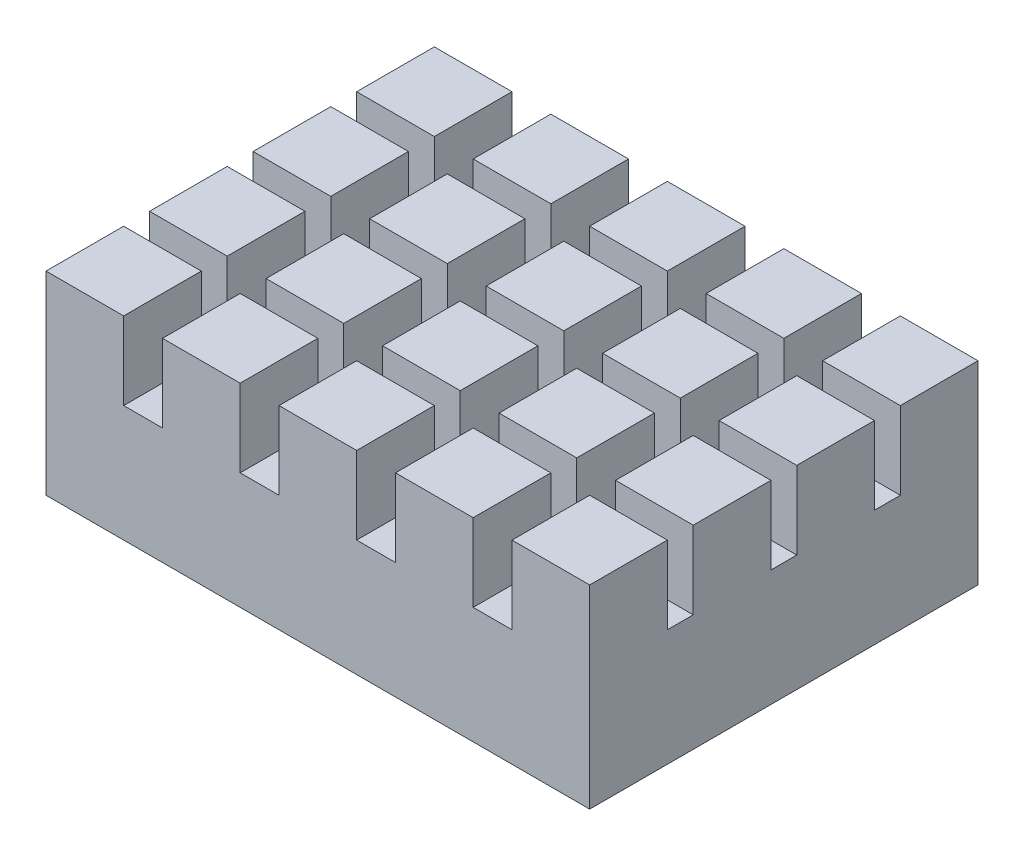
from build123d import *

# Parameters (mm, degrees)
SKETCH1_W           = 14
SKETCH1_H           = 10
BOSS_EXTRUDE1_DEPTH = 3
SKETCH2_W           = 2
SKETCH2_H           = 2
BOSS_EXTRUDE2_DEPTH = 2


with BuildPart() as part:
    # Sketch1 → Boss-Extrude1 (new body)
    with BuildSketch(Plane(origin=(0, 0, 0), x_dir=(1, 0, 0), z_dir=(0, 1, 0))):
        with Locations((7, 5)):
            Rectangle(SKETCH1_W, SKETCH1_H)
    extrude(amount=BOSS_EXTRUDE1_DEPTH)

    # Sketch2 → Boss-Extrude2 (add)
    with BuildSketch(Plane(origin=(0, 3, 0), x_dir=(1, 0, 0), z_dir=(0, 1, 0))):
        with Locations((4, 1)):
            Rectangle(SKETCH2_W, SKETCH2_H)
        with Locations((1, 1)):
            Rectangle(SKETCH2_W, SKETCH2_H)
        with Locations((7, 1)):
            Rectangle(SKETCH2_W, SKETCH2_H)
        with Locations((10, 1)):
            Rectangle(SKETCH2_W, SKETCH2_H)
        with Locations((4, 3.666666667)):
            Rectangle(SKETCH2_W, SKETCH2_H)
        with Locations((7, 3.666666667)):
            Rectangle(SKETCH2_W, SKETCH2_H)
        with Locations((10, 3.666666667)):
            Rectangle(SKETCH2_W, SKETCH2_H)
        with Locations((4, 6.333333333)):
            Rectangle(SKETCH2_W, SKETCH2_H)
        with Locations((7, 6.333333333)):
            Rectangle(SKETCH2_W, SKETCH2_H)
        with Locations((10, 6.333333333)):
            Rectangle(SKETCH2_W, SKETCH2_H)
        with Locations((4, 9)):
            Rectangle(SKETCH2_W, SKETCH2_H)
        with Locations((7, 9)):
            Rectangle(SKETCH2_W, SKETCH2_H)
        with Locations((10, 9)):
            Rectangle(SKETCH2_W, SKETCH2_H)
        with Locations((1, 3.666666667)):
            Rectangle(SKETCH2_W, SKETCH2_H)
        with Locations((1, 6.333333333)):
            Rectangle(SKETCH2_W, SKETCH2_H)
        with Locations((1, 9)):
            Rectangle(SKETCH2_W, SKETCH2_H)
        with Locations((13, 1)):
            Rectangle(SKETCH2_W, SKETCH2_H)
        with Locations((13, 3.666666667)):
            Rectangle(SKETCH2_W, SKETCH2_H)
        with Locations((13, 6.333333333)):
            Rectangle(SKETCH2_W, SKETCH2_H)
        with Locations((13, 9)):
            Rectangle(SKETCH2_W, SKETCH2_H)
    extrude(amount=BOSS_EXTRUDE2_DEPTH)


solid = part.part
